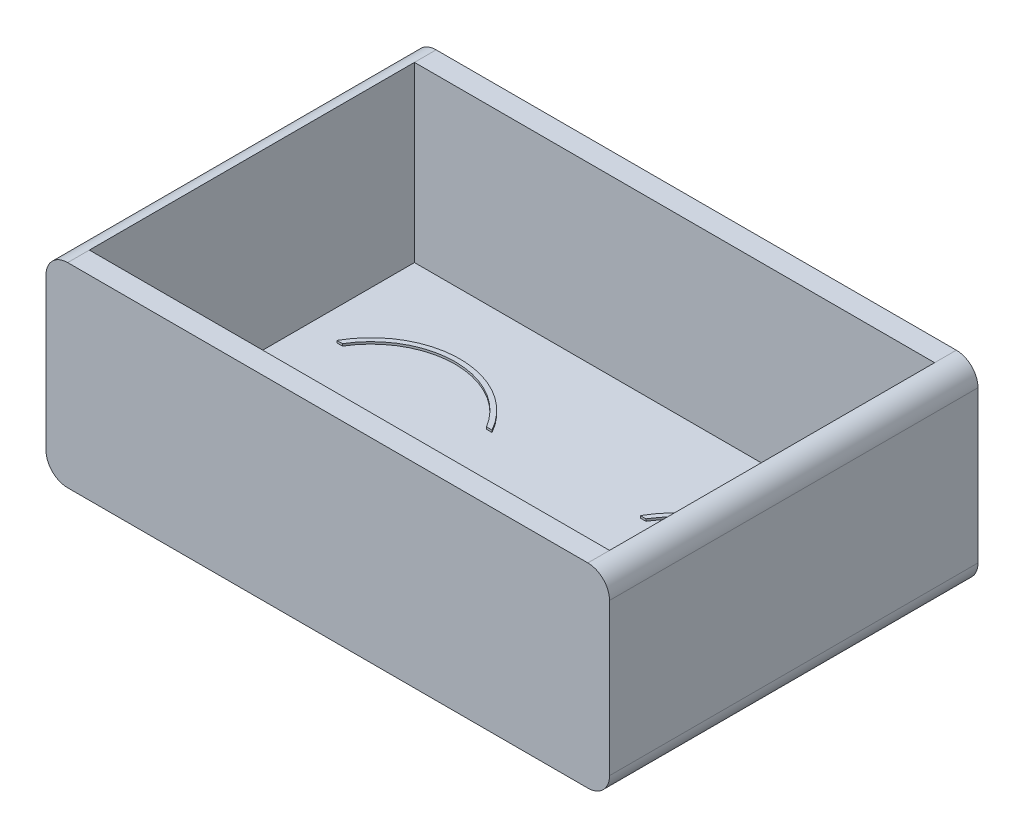
from build123d import *

# Parameters (mm, degrees)
SKETCH1_W           = 260
SKETCH1_H           = 90
BOSS_EXTRUDE1_DEPTH = 10
BOSS_EXTRUDE2_DEPTH = 160
SKETCH3_W           = 240
SKETCH3_H           = 10
BOSS_EXTRUDE3_DEPTH = 80
SKETCH4_R           = 5
BOSS_EXTRUDE4_DEPTH = 15
BOSS_EXTRUDE5_DEPTH = 5
BOSS_EXTRUDE6_DEPTH = 1
BOSS_EXTRUDE7_DEPTH = 1
CUT_EXTRUDE1_DEPTH  = 209


with BuildPart() as part:
    # Sketch1 → Boss-Extrude1 (new body)
    with BuildSketch(Plane.XY):
        Rectangle(SKETCH1_W, SKETCH1_H)
    extrude(amount=BOSS_EXTRUDE1_DEPTH)

    # Sketch2 → Boss-Extrude2 (add)
    with BuildSketch(Plane.XY.offset(10)):
        Polygon((-130, 45), (-130, -45), (130, -45), (130, 45), (120, 45), (120, -35), (-120, -35), (-120, 45), align=None)
    extrude(amount=BOSS_EXTRUDE2_DEPTH)

    # Sketch3 → Boss-Extrude3 (add)
    with BuildSketch(Plane(origin=(0, -35, 0), x_dir=(1, 0, 0), z_dir=(0, 1, 0))):
        with Locations((0, -165)):
            Rectangle(SKETCH3_W, SKETCH3_H)
    extrude(amount=BOSS_EXTRUDE3_DEPTH)

    # Sketch4 → Boss-Extrude4 (add)
    with BuildSketch(Plane(origin=(0, 0, 0), x_dir=(-1, 0, 0), z_dir=(0, 0, -1))):
        with Locations((-40, 0)):
            Circle(SKETCH4_R)
        with Locations((40, 0)):
            Circle(SKETCH4_R)
    extrude(amount=BOSS_EXTRUDE4_DEPTH)

    # Sketch5 → Boss-Extrude5 (add)
    with BuildSketch(Plane(origin=(0, 0, -15), x_dir=(-1, 0, 0), z_dir=(0, 0, -1))):
        with BuildLine():
            Line((-45, 7.5), (45, 7.5))
            ThreePointArc((45, 7.5), (48.535533906, 6.035533906), (50, 2.5))
            Line((50, 2.5), (50, -2.5))
            ThreePointArc((50, -2.5), (48.535533906, -6.035533906), (45, -7.5))
            Line((45, -7.5), (-45, -7.5))
            ThreePointArc((-45, -7.5), (-48.535533906, -6.035533906), (-50, -2.5))
            Line((-50, -2.5), (-50, 2.5))
            ThreePointArc((-50, 2.5), (-48.535533906, 6.035533906), (-45, 7.5))
        make_face()
    extrude(amount=BOSS_EXTRUDE5_DEPTH)

    # Sketch6 → Boss-Extrude6 (add)
    # profile 1 of 7: a face of its own
    with BuildSketch(Plane(origin=(0, 0, -20), x_dir=(-1, 0, 0), z_dir=(0, 0, -1))):
        with BuildLine():
            Line((-17.903472222, -1.672949219), (-17.321940104, -1.324305556))
            add(Edge.make_bspline(
                [(-17.321940104, -1.324305556), (-17.267853664, -1.414844007), (-17.164226132, -1.588312187), (-16.99135983, -1.822711026), (-16.812240263, -2.021935932), (-16.625540989, -2.184827931), (-16.432401608, -2.313073064), (-16.231561283, -2.403882451), (-16.023696824, -2.460519564), (-15.882233992, -2.467398901), (-15.811610243, -2.470833333)],
                knots=[0, 0, 0, 0, 1.272034388, 2.437168799, 3.508375237, 4.49857839, 5.41946034, 6.295179144, 7.148887113, 8, 8, 8, 8], degree=3))
            add(Edge.make_bspline(
                [(-15.811610243, -2.470833333), (-15.751295949, -2.469153495), (-15.63172272, -2.465823211), (-15.455690264, -2.433823682), (-15.284729603, -2.384662938), (-15.122364292, -2.31425775), (-14.970834698, -2.229076989), (-14.837955348, -2.126191823), (-14.723080904, -2.011002721), (-14.629113227, -1.88249467), (-14.557019491, -1.744287989), (-14.501608652, -1.602427875), (-14.470858632, -1.454685844), (-14.46622649, -1.355212184), (-14.463888889, -1.305013021)],
                knots=[0, 0, 0, 0, 1.095163259, 2.171163733, 3.241058638, 4.321873601, 5.38011039, 6.391990106, 7.366004449, 8.327778327, 9.272591725, 10.192022065, 11.087607919, 12, 12, 12, 12], degree=3))
            add(Edge.make_bspline(
                [(-14.463888889, -1.305013021), (-14.466786611, -1.247737375), (-14.472677258, -1.131304355), (-14.522465679, -0.959522418), (-14.600788425, -0.789523331), (-14.673044526, -0.684367868), (-14.710557726, -0.629774306)],
                knots=[0, 0, 0, 0, 0.938893495, 1.908633276, 2.914225137, 4, 4, 4, 4], degree=3))
            add(Edge.make_bspline(
                [(-14.710557726, -0.629774306), (-14.741357945, -0.590372751), (-14.806019152, -0.507654116), (-14.917181596, -0.384526397), (-15.047622614, -0.257520433), (-15.192878291, -0.121786501), (-15.358239874, 0.01636249), (-15.53852812, 0.163514307), (-15.738346014, 0.314072883), (-15.878483477, 0.415044438), (-15.950792101, 0.467144097)],
                knots=[0, 0, 0, 0, 0.722233717, 1.516239348, 2.393582979, 3.351407094, 4.387010283, 5.505090956, 6.712668013, 8, 8, 8, 8], degree=3))
            add(Edge.make_bspline(
                [(-15.950792101, 0.467144097), (-16.023168788, 0.518695762), (-16.161547504, 0.617258619), (-16.355065503, 0.763537777), (-16.528114799, 0.897276382), (-16.679926247, 1.019733435), (-16.810433074, 1.130925542), (-16.920663683, 1.229784944), (-17.007810061, 1.318985252), (-17.056270018, 1.376851509), (-17.078027344, 1.402832031)],
                knots=[0, 0, 0, 0, 1.452282411, 2.77665338, 3.964542531, 5.026858415, 5.96415736, 6.766646006, 7.446254459, 8, 8, 8, 8], degree=3))
            add(Edge.make_bspline(
                [(-17.078027344, 1.402832031), (-17.108438263, 1.443322879), (-17.168245417, 1.522953564), (-17.247190744, 1.647417065), (-17.314290456, 1.774825649), (-17.366891183, 1.905521688), (-17.411185584, 2.03767034), (-17.440978136, 2.172995824), (-17.459633251, 2.310890918), (-17.461543667, 2.403687929), (-17.4625, 2.450141059)],
                knots=[0, 0, 0, 0, 1.068054152, 2.10047183, 3.106115577, 4.101338837, 5.06977816, 6.043150881, 7.020423561, 8, 8, 8, 8], degree=3))
            add(Edge.make_bspline(
                [(-17.4625, 2.450141059), (-17.459934643, 2.522922199), (-17.454858761, 2.666928834), (-17.411931744, 2.877295383), (-17.344176093, 3.078140353), (-17.249253641, 3.26747533), (-17.126888296, 3.440370371), (-16.985283648, 3.598814261), (-16.816623215, 3.732011795), (-16.631568476, 3.848391686), (-16.42901363, 3.939483499), (-16.216760081, 4.008198473), (-15.994470479, 4.047133097), (-15.843908842, 4.052720484), (-15.767513021, 4.055555556)],
                knots=[0, 0, 0, 0, 1.005424448, 1.989358655, 2.955360095, 3.929531133, 4.905563448, 5.876582895, 6.856512386, 7.866279853, 8.892233794, 9.918561126, 10.94386622, 12, 12, 12, 12], degree=3))
            add(Edge.make_bspline(
                [(-15.767513021, 4.055555556), (-15.686448724, 4.052759564), (-15.52523771, 4.04719923), (-15.288104549, 3.998853368), (-15.059793427, 3.918857166), (-14.876132915, 3.828074459), (-14.732392213, 3.73740426), (-14.622772235, 3.654815296), (-14.511688531, 3.559735171), (-14.398245069, 3.451910629), (-14.284364082, 3.330352313), (-14.168354892, 3.195892732), (-14.049946216, 3.049353597), (-13.973772496, 2.944742108), (-13.934722222, 2.891113281)],
                knots=[0, 0, 0, 0, 1.286793592, 2.559021753, 3.825965368, 5.121522368, 5.803751409, 6.523245864, 7.299691795, 8.125521123, 9.008227632, 9.944561021, 10.946284179, 12, 12, 12, 12], degree=3))
            Line((-13.934722222, 2.891113281), (-14.492827691, 2.468055556))
            add(Edge.make_bspline(
                [(-14.492827691, 2.468055556), (-14.526527613, 2.511470351), (-14.591425784, 2.595077095), (-14.689954096, 2.712163098), (-14.782820189, 2.819117393), (-14.874313891, 2.912015876), (-14.959603041, 2.995945903), (-15.042383085, 3.067803234), (-15.121462744, 3.128291934), (-15.221145624, 3.19284517), (-15.346381283, 3.256834202), (-15.503588984, 3.310981259), (-15.667875818, 3.343519839), (-15.779769653, 3.347822046), (-15.836414931, 3.35)],
                knots=[0, 0, 0, 0, 1.181633172, 2.275549214, 3.290209073, 4.226197932, 5.078386478, 5.862611352, 6.581680152, 7.217281963, 8.414376989, 9.595101626, 10.782541182, 12, 12, 12, 12], degree=3))
            add(Edge.make_bspline(
                [(-15.836414931, 3.35), (-15.907479714, 3.347618433), (-16.044521456, 3.343025804), (-16.239084408, 3.292866881), (-16.414196396, 3.213890391), (-16.56465864, 3.103204642), (-16.689932151, 2.97206612), (-16.780551333, 2.821159108), (-16.83509362, 2.654521315), (-16.841749272, 2.538279797), (-16.845138889, 2.479079861)],
                knots=[0, 0, 0, 0, 1.14458467, 2.207223713, 3.21896685, 4.227309161, 5.202851033, 6.127160689, 7.046193047, 8, 8, 8, 8], degree=3))
            add(Edge.make_bspline(
                [(-16.845138889, 2.479079861), (-16.844366208, 2.442224277), (-16.842819582, 2.368452841), (-16.821248879, 2.259464392), (-16.793536983, 2.150751271), (-16.749623073, 2.042802242), (-16.688997363, 1.933729401), (-16.609385404, 1.821654533), (-16.509119954, 1.705589806), (-16.432315016, 1.630101027), (-16.391764323, 1.590245226)],
                knots=[0, 0, 0, 0, 0.858281714, 1.717966888, 2.583508476, 3.4729293, 4.427298488, 5.488583878, 6.674047936, 8, 8, 8, 8], degree=3))
            add(Edge.make_bspline(
                [(-16.391764323, 1.590245226), (-16.376706078, 1.576807214), (-16.340931134, 1.544881575), (-16.275528095, 1.492615081), (-16.189159571, 1.428142013), (-16.084080888, 1.348368608), (-15.958354561, 1.255831116), (-15.811966767, 1.151712742), (-15.646549278, 1.032633465), (-15.529167274, 0.949380728), (-15.467100694, 0.905360243)],
                knots=[0, 0, 0, 0, 0.420754252, 0.999615792, 1.744751191, 2.668019286, 3.750313428, 4.999500688, 6.413464383, 8, 8, 8, 8], degree=3))
            add(Edge.make_bspline(
                [(-15.467100694, 0.905360243), (-15.392440286, 0.851031809), (-15.247870754, 0.745832326), (-15.042168772, 0.587777222), (-14.855657252, 0.433196905), (-14.68768136, 0.283078537), (-14.536581627, 0.138560821), (-14.404034392, -0.002094906), (-14.288689085, -0.137880954), (-14.164511835, -0.311968243), (-14.037624978, -0.525774874), (-13.928656015, -0.787730079), (-13.859946216, -1.050703561), (-13.850961011, -1.227452617), (-13.846527778, -1.314659288)],
                knots=[0, 0, 0, 0, 1.163667725, 2.253281268, 3.268753668, 4.215851969, 5.092017293, 5.902905408, 6.650798638, 7.335211899, 8.59617414, 9.77448103, 10.901945474, 12, 12, 12, 12], degree=3))
            add(Edge.make_bspline(
                [(-13.846527778, -1.314659288), (-13.847819367, -1.376332718), (-13.850377464, -1.49848192), (-13.879782784, -1.677841601), (-13.922865364, -1.852043465), (-13.987799261, -2.018934235), (-14.067053468, -2.181567096), (-14.16761951, -2.335675957), (-14.284187352, -2.484671629), (-14.417906097, -2.624581086), (-14.564227746, -2.753017479), (-14.718878674, -2.867268765), (-14.882112008, -2.962532101), (-15.053042233, -3.040268339), (-15.231708612, -3.101067431), (-15.418051053, -3.145119392), (-15.612376724, -3.172155914), (-15.74445767, -3.174962145), (-15.811610243, -3.176388889)],
                knots=[0, 0, 0, 0, 0.983748083, 1.948392443, 2.894712957, 3.844097841, 4.80183111, 5.778335162, 6.776009319, 7.81870978, 8.863265674, 9.881300176, 10.883814829, 11.87499822, 12.874611388, 13.892143829, 14.928324115, 16, 16, 16, 16], degree=3))
            add(Edge.make_bspline(
                [(-15.811610243, -3.176388889), (-15.86356828, -3.175384174), (-15.966829997, -3.173387396), (-16.119566133, -3.155734904), (-16.269216683, -3.130759394), (-16.413903801, -3.09110774), (-16.555491619, -3.042998824), (-16.693364338, -2.983762649), (-16.827588779, -2.91277515), (-16.958917147, -2.831610762), (-17.087015435, -2.737154409), (-17.210682151, -2.627139835), (-17.333974872, -2.504601229), (-17.453254504, -2.366210943), (-17.570933744, -2.214204783), (-17.68469238, -2.047160566), (-17.796885137, -1.865988172), (-17.867279586, -1.738497391), (-17.903472222, -1.672949219)],
                knots=[0, 0, 0, 0, 0.915332311, 1.819136955, 2.706846663, 3.586547465, 4.459518054, 5.340707479, 6.227863349, 7.133153174, 8.059268498, 9.028702269, 10.047606654, 11.120612155, 12.245963614, 13.433783089, 14.680604001, 16, 16, 16, 16], degree=3))
        make_face()
    # profile 2 of 7: a face of its own
    with BuildSketch(Plane(origin=(0, 0, -20), x_dir=(-1, 0, 0), z_dir=(0, 0, -1))):
        Polygon((-11.994444444, 4.055555556), (-11.377083333, 4.055555556), (-11.377083333, 2.027083333), (-10.495138889, 2.027083333), (-10.495138889, 1.409722222), (-11.377083333, 1.409722222), (-11.377083333, -3), (-11.994444444, -3), (-11.994444444, 1.409722222), (-12.876388889, 1.409722222), (-12.876388889, 2.027083333), (-11.994444444, 2.027083333), align=None)
    # profile 3 of 7: a face of its own
    with BuildSketch(Plane(origin=(0, 0, -20), x_dir=(-1, 0, 0), z_dir=(0, 0, -1))):
        with BuildLine():
            add(Edge.make_bspline(
                [(-7.008702257, 2.115277778), (-6.914376553, 2.113269275), (-6.729426899, 2.109331092), (-6.458568781, 2.067240487), (-6.200019948, 2.002876322), (-5.952790182, 1.913896145), (-5.720045773, 1.794627216), (-5.498396578, 1.652308478), (-5.28845029, 1.483704833), (-5.16261455, 1.353279629), (-5.098741319, 1.287076823)],
                knots=[0, 0, 0, 0, 1.054011418, 2.066658804, 3.057071809, 4.030435133, 4.997543892, 5.974964718, 6.972108034, 8, 8, 8, 8], degree=3))
            add(Edge.make_bspline(
                [(-5.098741319, 1.287076823), (-5.043743455, 1.223761001), (-4.934812086, 1.098354692), (-4.795134108, 0.895015148), (-4.674804589, 0.684433831), (-4.578372507, 0.463814383), (-4.502338014, 0.235082738), (-4.448354842, -0.002547286), (-4.416244986, -0.248550899), (-4.411915107, -0.415623919), (-4.409722222, -0.500238715)],
                knots=[0, 0, 0, 0, 1.025258237, 2.030674902, 3.01204498, 3.988269485, 4.97094183, 5.956517959, 6.965070386, 8, 8, 8, 8], degree=3))
            add(Edge.make_bspline(
                [(-4.409722222, -0.500238715), (-4.411651017, -0.585343948), (-4.415462406, -0.753515856), (-4.451516348, -1.001203919), (-4.507593518, -1.241374934), (-4.587847523, -1.47302339), (-4.690756141, -1.696857376), (-4.816331766, -1.91189924), (-4.965455623, -2.118573254), (-5.134494431, -2.315124486), (-5.32131663, -2.496274987), (-5.523988965, -2.654158288), (-5.738528619, -2.789425356), (-5.967788353, -2.898384311), (-6.209674568, -2.984294686), (-6.464708996, -3.044634837), (-6.732495437, -3.081117385), (-6.915338226, -3.085802241), (-7.008702257, -3.088194444)],
                knots=[0, 0, 0, 0, 0.998656419, 1.973391657, 2.932242238, 3.890759089, 4.846373663, 5.82037756, 6.809684879, 7.83454468, 8.860553229, 9.859544525, 10.845671541, 11.83227036, 12.833544569, 13.85385346, 14.904124723, 16, 16, 16, 16], degree=3))
            add(Edge.make_bspline(
                [(-7.008702257, -3.088194444), (-7.102523712, -3.085794212), (-7.28627777, -3.081093237), (-7.555009433, -3.044776577), (-7.810500934, -2.984322495), (-8.05270381, -2.898101982), (-8.282949217, -2.789421873), (-8.498731963, -2.654567231), (-8.70156894, -2.496228164), (-8.888430662, -2.315137173), (-9.057458873, -2.118569985), (-9.206585464, -1.911900088), (-9.332160379, -1.696857155), (-9.435069182, -1.473023449), (-9.515323138, -1.241374918), (-9.571400322, -1.001203923), (-9.607454259, -0.753515855), (-9.611265649, -0.585343947), (-9.613194444, -0.500238715)],
                knots=[0, 0, 0, 0, 1.099876186, 2.154163076, 3.173186993, 4.173200201, 5.163417411, 6.152872554, 7.150605724, 8.17532212, 9.198891216, 10.186952605, 11.159729845, 12.11414092, 13.071450619, 14.029093627, 15.002601286, 16, 16, 16, 16], degree=3))
            add(Edge.make_bspline(
                [(-9.613194444, -0.500238715), (-9.610986605, -0.416083814), (-9.606615461, -0.249471572), (-9.574537889, -0.003930408), (-9.520765298, 0.233297436), (-9.44463966, 0.461146199), (-9.347318732, 0.680798848), (-9.228680057, 0.891900486), (-9.087577278, 1.094320555), (-8.979079157, 1.219564787), (-8.924175347, 1.282942708)],
                knots=[0, 0, 0, 0, 1.031353054, 2.041901799, 3.029428768, 4.008703097, 4.981709435, 5.96992636, 6.972712378, 8, 8, 8, 8], degree=3))
            add(Edge.make_bspline(
                [(-8.924175347, 1.282942708), (-8.860398414, 1.349719643), (-8.734969853, 1.481048234), (-8.523978485, 1.649160373), (-8.302874558, 1.794440656), (-8.067558066, 1.911339742), (-7.820531401, 2.003399733), (-7.560657628, 2.067406478), (-7.288880395, 2.109179441), (-7.103025711, 2.11322474), (-7.008702257, 2.115277778)],
                knots=[0, 0, 0, 0, 1.027980169, 2.021703884, 2.998553061, 3.971491411, 4.943284454, 5.930300938, 6.949603206, 8, 8, 8, 8], degree=3))
        make_face()
        with BuildLine():
            add(Edge.make_bspline(
                [(-7.011458333, 1.497916667), (-7.0781619, 1.496020785), (-7.209847093, 1.492277963), (-7.403681538, 1.463810193), (-7.59028415, 1.41870742), (-7.770008952, 1.354624924), (-7.942249866, 1.27188054), (-8.107171799, 1.170248989), (-8.265259844, 1.051076357), (-8.413421495, 0.91454913), (-8.549397682, 0.765410773), (-8.668265705, 0.606505248), (-8.769340528, 0.440410037), (-8.85354184, 0.266952417), (-8.916254658, 0.084374589), (-8.961800682, -0.105255794), (-8.990241596, -0.302325083), (-8.993949228, -0.436293942), (-8.995833333, -0.50437283)],
                knots=[0, 0, 0, 0, 1.021534396, 2.016698045, 2.994645724, 3.958388632, 4.93408049, 5.916473867, 6.921342795, 7.962252576, 8.998418191, 10.008913653, 10.997312074, 11.973003931, 12.956656626, 13.948281152, 14.957379055, 16, 16, 16, 16], degree=3))
            add(Edge.make_bspline(
                [(-8.995833333, -0.50437283), (-8.99267516, -0.592331874), (-8.986406776, -0.766914128), (-8.935431686, -1.024020275), (-8.850156986, -1.270848415), (-8.735005083, -1.505951574), (-8.590726908, -1.723475301), (-8.420738637, -1.917411755), (-8.226864655, -2.084842439), (-8.011416033, -2.223763958), (-7.77879344, -2.33414462), (-7.532605123, -2.41236856), (-7.275833949, -2.463218755), (-7.100354798, -2.468272927), (-7.011458333, -2.470833333)],
                knots=[0, 0, 0, 0, 1.016792936, 2.018143844, 3.017858371, 4.030088057, 5.03801393, 6.028138512, 7.003788237, 7.991172063, 8.984598303, 9.972568034, 10.972917682, 12, 12, 12, 12], degree=3))
            add(Edge.make_bspline(
                [(-7.011458333, -2.470833333), (-6.922566982, -2.468258009), (-6.747097924, -2.463174389), (-6.490683518, -2.412624661), (-6.24516808, -2.333801871), (-6.012787103, -2.223888099), (-5.797436553, -2.084314889), (-5.60216822, -1.9183572), (-5.433631367, -1.722961642), (-5.289495912, -1.505663452), (-5.172458207, -1.271212898), (-5.087582652, -1.023974719), (-5.036485016, -0.76692573), (-5.030233173, -0.592335761), (-5.027083333, -0.50437283)],
                knots=[0, 0, 0, 0, 1.02726834, 2.027799167, 3.010890988, 4.004497153, 4.992059811, 5.971914811, 6.958719428, 7.966827853, 8.981595046, 9.981490638, 10.983022906, 12, 12, 12, 12], degree=3))
            add(Edge.make_bspline(
                [(-5.027083333, -0.50437283), (-5.02896679, -0.436293535), (-5.032673146, -0.302323876), (-5.061123344, -0.10526041), (-5.106635006, 0.084391525), (-5.169474458, 0.266889927), (-5.253309907, 0.440859147), (-5.356333866, 0.606017575), (-5.474716512, 0.765961238), (-5.612333496, 0.914067025), (-5.760340492, 1.051129579), (-5.918492609, 1.170295201), (-6.08316999, 1.271433879), (-6.254910513, 1.355332669), (-6.434658358, 1.418124406), (-6.620999513, 1.464070618), (-6.814006936, 1.49215766), (-6.945220245, 1.49598472), (-7.011458333, 1.497916667)],
                knots=[0, 0, 0, 0, 1.042956736, 2.052379634, 3.044323526, 4.02829302, 5.004299113, 5.996692471, 7.007513377, 8.048758398, 9.090003419, 10.095195979, 11.07790575, 12.047570684, 13.018257071, 13.989683339, 14.985167495, 16, 16, 16, 16], degree=3))
        make_face(mode=Mode.SUBTRACT)
    # profile 4 of 7: a face of its own
    with BuildSketch(Plane(origin=(0, 0, -20), x_dir=(-1, 0, 0), z_dir=(0, 0, -1))):
        with BuildLine():
            Line((-3.351388889, 2.027083333), (-2.734027778, 2.027083333))
            Line((-2.734027778, 2.027083333), (-2.734027778, 1.287076823))
            add(Edge.make_bspline(
                [(-2.734027778, 1.287076823), (-2.688450825, 1.355978219), (-2.601285256, 1.487751603), (-2.456404248, 1.662029003), (-2.308004248, 1.806324529), (-2.155374826, 1.921311802), (-1.997393585, 2.007425444), (-1.837527743, 2.070503541), (-1.673262147, 2.107803002), (-1.562877222, 2.112782848), (-1.507573785, 2.115277778)],
                knots=[0, 0, 0, 0, 1.2804753, 2.448899062, 3.506932113, 4.484331642, 5.4025378, 6.288909075, 7.142734305, 8, 8, 8, 8], degree=3))
            add(Edge.make_bspline(
                [(-1.507573785, 2.115277778), (-1.46467466, 2.112937826), (-1.376406922, 2.108123223), (-1.24278876, 2.074295757), (-1.105120023, 2.020288358), (-1.016393736, 1.969500016), (-0.970138889, 1.943023003)],
                knots=[0, 0, 0, 0, 0.901110191, 1.854092781, 2.881294221, 4, 4, 4, 4], degree=3))
            Line((-0.970138889, 1.943023003), (-1.309136285, 1.408344184))
            add(Edge.make_bspline(
                [(-1.309136285, 1.408344184), (-1.338832706, 1.421592017), (-1.395202199, 1.446738939), (-1.4776629, 1.476500199), (-1.553690146, 1.49402422), (-1.602126473, 1.496679023), (-1.624707031, 1.497916667)],
                knots=[0, 0, 0, 0, 1.180555205, 2.24091978, 3.179933427, 4, 4, 4, 4], degree=3))
            add(Edge.make_bspline(
                [(-1.624707031, 1.497916667), (-1.6742483, 1.494614593), (-1.775298129, 1.487879321), (-1.923661115, 1.434931735), (-2.067626753, 1.349383912), (-2.181961771, 1.254508191), (-2.270491246, 1.163019604), (-2.333662094, 1.083126136), (-2.391609732, 0.993542421), (-2.446977629, 0.895799912), (-2.497424119, 0.788229702), (-2.544506451, 0.671906505), (-2.587076431, 0.546695592), (-2.611350542, 0.459462805), (-2.623784722, 0.414778646)],
                knots=[0, 0, 0, 0, 1.125678352, 2.296057538, 3.5422874, 4.923748041, 5.663163013, 6.437101912, 7.23742474, 8.08941207, 8.991984279, 9.93940061, 10.944477711, 12, 12, 12, 12], degree=3))
            add(Edge.make_bspline(
                [(-2.623784722, 0.414778646), (-2.633086129, 0.374924344), (-2.653688037, 0.286650094), (-2.673719262, 0.138554362), (-2.69351066, -0.036419519), (-2.707458894, -0.238758596), (-2.72038788, -0.467957579), (-2.727679958, -0.724365634), (-2.733779107, -1.008245946), (-2.733942373, -1.206708633), (-2.734027778, -1.310525174)],
                knots=[0, 0, 0, 0, 0.566838948, 1.255505196, 2.06880316, 3.007127437, 4.065329342, 5.249902469, 6.561414163, 8, 8, 8, 8], degree=3))
            Line((-2.734027778, -1.310525174), (-2.734027778, -3))
            Line((-2.734027778, -3), (-3.351388889, -3))
            Line((-3.351388889, -3), (-3.351388889, 2.027083333))
        make_face()
    # profile 5 of 7: a face of its own
    with BuildSketch(Plane(origin=(0, 0, -20), x_dir=(-1, 0, 0), z_dir=(0, 0, -1))):
        with BuildLine():
            Line((4.7625, 2.027083333), (4.7625, -3))
            Line((4.7625, -3), (4.145138889, -3))
            Line((4.145138889, -3), (4.145138889, -2.130457899))
            add(Edge.make_bspline(
                [(4.145138889, -2.130457899), (4.075524099, -2.209154768), (3.939669962, -2.362732697), (3.712773193, -2.563372776), (3.472261453, -2.729216358), (3.219302071, -2.863163395), (2.954123476, -2.963780163), (2.677313499, -3.035296292), (2.388759226, -3.081276318), (2.191715609, -3.085867713), (2.091861979, -3.088194444)],
                knots=[0, 0, 0, 0, 1.074387032, 2.096679803, 3.090159297, 4.057316773, 5.018401886, 5.985159533, 6.978961417, 8, 8, 8, 8], degree=3))
            add(Edge.make_bspline(
                [(2.091861979, -3.088194444), (2.003085441, -3.085784039), (1.828014178, -3.081030613), (1.570479647, -3.044153752), (1.322648332, -2.984932732), (1.084286047, -2.902577531), (0.8569352, -2.79333475), (0.638649224, -2.662549511), (0.430558969, -2.506803546), (0.235836218, -2.328754933), (0.056521893, -2.135361929), (-0.100836632, -1.929093955), (-0.232038221, -1.710842951), (-0.341751261, -1.483372192), (-0.426259552, -1.244930606), (-0.485172017, -0.996342744), (-0.522005918, -0.737902528), (-0.52675738, -0.561914728), (-0.529166667, -0.472677951)],
                knots=[0, 0, 0, 0, 1.033919861, 2.038935746, 3.024066025, 3.998881131, 4.97069526, 5.957263378, 6.95902576, 7.993208707, 9.027059324, 10.027763471, 11.009749337, 11.988697705, 12.965288445, 13.950418724, 14.960734635, 16, 16, 16, 16], degree=3))
            add(Edge.make_bspline(
                [(-0.529166667, -0.472677951), (-0.526703981, -0.385285601), (-0.521835385, -0.212515638), (-0.485566021, 0.041578565), (-0.424575312, 0.286316242), (-0.338983054, 0.520909472), (-0.229227021, 0.745642118), (-0.095715984, 0.960673124), (0.061559701, 1.166594881), (0.24287961, 1.358565351), (0.439299021, 1.535891821), (0.649425587, 1.690002933), (0.868032298, 1.823098787), (1.098509953, 1.928553417), (1.337447203, 2.013872978), (1.586971178, 2.072902062), (1.846043698, 2.107685725), (2.021935129, 2.112722777), (2.111154514, 2.115277778)],
                knots=[0, 0, 0, 0, 1.020392517, 2.01726096, 2.990465484, 3.961182959, 4.928053699, 5.906110375, 6.912531644, 7.948652711, 8.985773172, 9.998621852, 10.987621588, 11.969261332, 12.953316658, 13.946091881, 14.958173133, 16, 16, 16, 16], degree=3))
            add(Edge.make_bspline(
                [(2.111154514, 2.115277778), (2.213752094, 2.112451911), (2.414941106, 2.106910521), (2.709227944, 2.060795089), (2.987626793, 1.982886625), (3.252286715, 1.876913067), (3.502257326, 1.736089196), (3.73517212, 1.558449534), (3.953468683, 1.345114415), (4.080006613, 1.181251792), (4.145138889, 1.096907552)],
                knots=[0, 0, 0, 0, 1.038897134, 2.037228247, 3.008116434, 3.962042015, 4.918381754, 5.904844433, 6.921570401, 8, 8, 8, 8], degree=3))
            Line((4.145138889, 1.096907552), (4.145138889, 2.027083333))
            Line((4.145138889, 2.027083333), (4.7625, 2.027083333))
        make_face()
        with BuildLine():
            add(Edge.make_bspline(
                [(2.119422743, 1.497916667), (2.029179205, 1.494705791), (1.851052815, 1.488368032), (1.589557997, 1.438890127), (1.339326513, 1.356566954), (1.101609883, 1.243980741), (0.880163186, 1.102409974), (0.682252174, 0.931174969), (0.506258126, 0.734947695), (0.358241526, 0.514613666), (0.237579966, 0.27840649), (0.152736192, 0.031494648), (0.096780564, -0.221668469), (0.091063937, -0.393377748), (0.088194444, -0.479568142)],
                knots=[0, 0, 0, 0, 1.031046209, 2.035121221, 3.029706178, 4.034933723, 5.034054252, 6.02443088, 7.017295772, 8.038157696, 9.050218397, 10.03989886, 11.016116709, 12, 12, 12, 12], degree=3))
            add(Edge.make_bspline(
                [(0.088194444, -0.479568142), (0.091859848, -0.56524346), (0.099176287, -0.736258277), (0.15175414, -0.98976653), (0.239964463, -1.236736558), (0.360334279, -1.475072154), (0.511060014, -1.696353522), (0.685768544, -1.896321311), (0.886149395, -2.068280014), (1.108105721, -2.212226721), (1.345157816, -2.328509247), (1.594446888, -2.409419331), (1.851286744, -2.461657326), (2.02592389, -2.467759102), (2.11391059, -2.470833333)],
                knots=[0, 0, 0, 0, 0.979072187, 1.954306742, 2.945804271, 3.96968567, 4.997920485, 5.998718438, 6.996577872, 8.005894225, 9.015743152, 10.005417472, 10.995077863, 12, 12, 12, 12], degree=3))
            add(Edge.make_bspline(
                [(2.11391059, -2.470833333), (2.203234609, -2.467570714), (2.380891224, -2.461081687), (2.643161827, -2.411391962), (2.897681093, -2.329296383), (3.140981944, -2.215497028), (3.367633054, -2.074459654), (3.571055668, -1.909345717), (3.74306622, -1.717312434), (3.888890028, -1.506266573), (4.003232424, -1.274906446), (4.086521559, -1.028565078), (4.135764415, -0.767233894), (4.141970857, -0.588643009), (4.145138889, -0.497482639)],
                knots=[0, 0, 0, 0, 1.01762866, 2.023962475, 3.030623092, 4.058876274, 5.077231937, 6.066672613, 7.034107872, 8.005628644, 8.981990164, 9.965428785, 10.961468474, 12, 12, 12, 12], degree=3))
            add(Edge.make_bspline(
                [(4.145138889, -0.497482639), (4.143252707, -0.428026974), (4.139540105, -0.291316247), (4.111177164, -0.090587043), (4.066059802, 0.101506269), (4.002484175, 0.285165649), (3.918968568, 0.459375662), (3.818242304, 0.625387171), (3.698534093, 0.782336757), (3.56177096, 0.928063198), (3.412070068, 1.060981399), (3.253663417, 1.179625877), (3.084674237, 1.277091429), (2.907944442, 1.357757071), (2.723167403, 1.421947853), (2.528839553, 1.464771046), (2.327026449, 1.494175201), (2.189352595, 1.49665638), (2.119422743, 1.497916667)],
                knots=[0, 0, 0, 0, 1.050140795, 2.067009409, 3.05949893, 4.030605086, 5.00011959, 5.97591094, 6.962425594, 7.979863591, 8.993523472, 9.986985069, 10.967611495, 11.937549037, 12.921786183, 13.919465291, 14.943216303, 16, 16, 16, 16], degree=3))
        make_face(mode=Mode.SUBTRACT)
    # profile 6 of 7: a face of its own
    with BuildSketch(Plane(origin=(0, 0, -20), x_dir=(-1, 0, 0), z_dir=(0, 0, -1))):
        with BuildLine():
            Line((10.583333333, 2.027083333), (11.200694444, 2.027083333))
            Line((11.200694444, 2.027083333), (11.200694444, -1.96233724))
            add(Edge.make_bspline(
                [(11.200694444, -1.96233724), (11.200149924, -2.047319702), (11.199098868, -2.211356326), (11.191529876, -2.448546611), (11.175568878, -2.667630548), (11.157469434, -2.869607321), (11.131433328, -3.05354073), (11.099639064, -3.219979622), (11.063797271, -3.369083716), (11.032309915, -3.460920279), (11.017415365, -3.504361979)],
                knots=[0, 0, 0, 0, 1.307562039, 2.523909702, 3.650326591, 4.686913197, 5.643429486, 6.506965704, 7.293745905, 8, 8, 8, 8], degree=3))
            add(Edge.make_bspline(
                [(11.017415365, -3.504361979), (10.995423182, -3.560829956), (10.95209637, -3.672077554), (10.87095044, -3.829776201), (10.780078803, -3.978260831), (10.676288392, -4.116703965), (10.56004855, -4.244410608), (10.434097903, -4.364155278), (10.295983515, -4.473404636), (10.145784356, -4.570273714), (9.986962807, -4.657515412), (9.819610171, -4.733081225), (9.644670136, -4.798898819), (9.460499333, -4.848198456), (9.269985265, -4.890917532), (9.070887576, -4.918718575), (8.864369496, -4.937640329), (8.723945302, -4.939390061), (8.652701823, -4.940277778)],
                knots=[0, 0, 0, 0, 0.981931301, 1.934503488, 2.87077864, 3.801706999, 4.735015492, 5.667491629, 6.616593066, 7.585388521, 8.561939025, 9.551802639, 10.560317337, 11.588439944, 12.640189604, 13.723962949, 14.845264515, 16, 16, 16, 16], degree=3))
            add(Edge.make_bspline(
                [(8.652701823, -4.940277778), (8.548758136, -4.938594375), (8.34572819, -4.935306238), (8.049717662, -4.896997308), (7.768586326, -4.842839844), (7.506048912, -4.760868819), (7.263764471, -4.660556831), (7.043387663, -4.545389846), (6.846896832, -4.413330859), (6.669760898, -4.26297075), (6.50988594, -4.084183799), (6.359473373, -3.873487024), (6.214694546, -3.627671031), (6.129847616, -3.447254638), (6.085416667, -3.352777778)],
                knots=[0, 0, 0, 0, 1.157897085, 2.2616841, 3.32207898, 4.345638746, 5.321241055, 6.241986252, 7.112515963, 7.955008012, 8.825025602, 9.77857164, 10.836726669, 12, 12, 12, 12], degree=3))
            Line((6.085416667, -3.352777778), (6.702777778, -3.352777778))
            add(Edge.make_bspline(
                [(6.702777778, -3.352777778), (6.752430049, -3.431604922), (6.849494124, -3.585702281), (7.031002865, -3.785223972), (7.229921489, -3.955735645), (7.452963105, -4.093143607), (7.70105576, -4.196743447), (7.974348711, -4.270596797), (8.275065825, -4.314812674), (8.484424839, -4.320141658), (8.593446181, -4.322916667)],
                knots=[0, 0, 0, 0, 0.997731894, 1.950442991, 2.880492273, 3.800895997, 4.748200782, 5.754801363, 6.83083817, 8, 8, 8, 8], degree=3))
            add(Edge.make_bspline(
                [(8.593446181, -4.322916667), (8.7010892, -4.320105743), (8.908614166, -4.314686564), (9.207034713, -4.270577064), (9.479439764, -4.196727375), (9.724259873, -4.093326844), (9.938606389, -3.966651105), (10.12338472, -3.825136673), (10.273045268, -3.665577344), (10.373703134, -3.518595485), (10.436273317, -3.387647344), (10.476117916, -3.274922182), (10.508497111, -3.147455395), (10.535581053, -3.005674323), (10.557930313, -2.8493764), (10.572087407, -2.678204251), (10.582319305, -2.492546899), (10.582987508, -2.363821695), (10.583333333, -2.297200521)],
                knots=[0, 0, 0, 0, 1.570740765, 3.028230971, 4.391408896, 5.680370741, 6.894727393, 8.017376726, 9.065722033, 10.075533815, 10.603371122, 11.180248986, 11.817768598, 12.521299649, 13.286540596, 14.121245857, 15.027658897, 16, 16, 16, 16], degree=3))
            Line((10.583333333, -2.297200521), (10.583333333, -2.036751302))
            add(Edge.make_bspline(
                [(10.583333333, -2.036751302), (10.520671756, -2.111325011), (10.3964508, -2.2591607), (10.181924327, -2.45288125), (9.947606318, -2.619722918), (9.693895689, -2.756556686), (9.427007132, -2.865997201), (9.149831296, -2.942538663), (8.864852863, -2.991989847), (8.671740602, -2.997311013), (8.574153646, -3)],
                knots=[0, 0, 0, 0, 1.012485704, 2.007162095, 2.997754123, 3.998611389, 4.999708251, 5.992315798, 6.98544096, 8, 8, 8, 8], degree=3))
            add(Edge.make_bspline(
                [(8.574153646, -3), (8.516690454, -2.998987728), (8.402444089, -2.996975162), (8.23271589, -2.979366899), (8.065492314, -2.95381818), (7.901163363, -2.916314066), (7.739491914, -2.868176161), (7.580745135, -2.80799969), (7.423637692, -2.739964499), (7.271025349, -2.659826525), (7.124428085, -2.570667991), (6.984951634, -2.474086671), (6.853326565, -2.370588059), (6.730805679, -2.259151574), (6.61754969, -2.139938499), (6.512035326, -2.014219659), (6.416007373, -1.880239552), (6.327495319, -1.74044121), (6.250728634, -1.59389349), (6.183343517, -1.443774162), (6.124753841, -1.290404213), (6.07804351, -1.133270165), (6.042367929, -0.972471081), (6.0158139, -0.808270387), (6.00075259, -0.640162446), (5.998403995, -0.526909056), (5.997222222, -0.469921875)],
                knots=[0, 0, 0, 0, 1.028754217, 2.045334182, 3.052854819, 4.056607503, 5.061168794, 6.071104265, 7.095078842, 8.125279047, 9.155117945, 10.165957491, 11.161587969, 12.151493252, 13.128948131, 14.104219989, 15.088194871, 16.07871515, 17.064853787, 18.047899887, 19.02414258, 20.002704429, 20.980574569, 21.971845993, 22.979467364, 24, 24, 24, 24], degree=3))
            add(Edge.make_bspline(
                [(5.997222222, -0.469921875), (5.998242631, -0.41291698), (6.000279497, -0.299127979), (6.017872434, -0.130334092), (6.042968006, 0.036199596), (6.082685895, 0.198756548), (6.130491234, 0.359188054), (6.189698398, 0.516309118), (6.260885507, 0.670167595), (6.341489194, 0.820877422), (6.432066381, 0.966416247), (6.531386769, 1.104641595), (6.639570262, 1.234536323), (6.755124372, 1.357410862), (6.879460037, 1.472079678), (7.012512932, 1.57826446), (7.152971522, 1.677745123), (7.301271123, 1.768375859), (7.455123466, 1.848532393), (7.610619791, 1.921672866), (7.769819894, 1.979721475), (7.929755683, 2.030869257), (8.093243825, 2.067103194), (8.258279738, 2.095056672), (8.425428428, 2.112086975), (8.537367987, 2.114212804), (8.593446181, 2.115277778)],
                knots=[0, 0, 0, 0, 1.008818848, 2.013730394, 3.001654427, 3.987803273, 4.973046549, 5.963777569, 6.957074694, 7.972068341, 8.987420212, 9.989399531, 10.982630087, 11.977756091, 12.973280677, 13.973972381, 14.989194003, 16.018387222, 17.047741039, 18.059210846, 19.057554164, 20.045176975, 21.029480261, 22.018708529, 23.007435371, 24, 24, 24, 24], degree=3))
            add(Edge.make_bspline(
                [(8.593446181, 2.115277778), (8.685923681, 2.112611269), (8.868538329, 2.107345733), (9.137279859, 2.066029172), (9.39660919, 2.000158177), (9.647989694, 1.905784598), (9.893469123, 1.776947559), (10.132238424, 1.60724255), (10.364988412, 1.395147347), (10.508621148, 1.232498562), (10.583333333, 1.147894965)],
                knots=[0, 0, 0, 0, 0.96728863, 1.910097829, 2.838038873, 3.762875196, 4.71315279, 5.730631239, 6.819562287, 8, 8, 8, 8], degree=3))
            Line((10.583333333, 1.147894965), (10.583333333, 2.027083333))
        make_face()
        with BuildLine():
            add(Edge.make_bspline(
                [(8.643055556, 1.497916667), (8.552779851, 1.49484843), (8.374053097, 1.488773971), (8.112078034, 1.436915445), (7.859166585, 1.355651063), (7.620154011, 1.239407661), (7.396272299, 1.097708153), (7.197612145, 0.926042897), (7.023854388, 0.729994122), (6.876870303, 0.51133441), (6.75986282, 0.275433485), (6.677030932, 0.02677965), (6.62347166, -0.230609271), (6.617560192, -0.406268994), (6.614583333, -0.494726562)],
                knots=[0, 0, 0, 0, 1.026226791, 2.031711442, 3.026614839, 4.04107745, 5.047145931, 6.032893242, 7.017642609, 8.019221815, 9.021877557, 10.003543541, 10.994637589, 12, 12, 12, 12], degree=3))
            add(Edge.make_bspline(
                [(6.614583333, -0.494726562), (6.616009791, -0.561421602), (6.618815216, -0.69259124), (6.645788582, -0.885085841), (6.689384741, -1.068426076), (6.751173821, -1.242623036), (6.827734415, -1.408675889), (6.924027754, -1.565440766), (7.037339366, -1.713057277), (7.166782361, -1.85043361), (7.309429512, -1.975557728), (7.464150224, -2.085502615), (7.630734649, -2.175424567), (7.805085773, -2.253141142), (7.991434056, -2.309902263), (8.187095415, -2.353218958), (8.393454094, -2.378001171), (8.534126644, -2.381072813), (8.605848524, -2.382638889)],
                knots=[0, 0, 0, 0, 1.039728707, 2.044842319, 3.024901384, 3.974314358, 4.923051295, 5.871625912, 6.837440708, 7.820715446, 8.810779094, 9.792721783, 10.773906224, 11.758876063, 12.764959493, 13.806266761, 14.881525401, 16, 16, 16, 16], degree=3))
            add(Edge.make_bspline(
                [(8.605848524, -2.382638889), (8.678499911, -2.381130172), (8.820568928, -2.378179891), (9.02806609, -2.352818372), (9.224678059, -2.311893273), (9.410224559, -2.253787851), (9.585406156, -2.179646648), (9.748254929, -2.085821463), (9.902262662, -1.978969466), (10.042511986, -1.854334662), (10.169332697, -1.716977368), (10.27985293, -1.567512938), (10.374027639, -1.408190417), (10.452013154, -1.239027767), (10.511549795, -1.058710356), (10.551486119, -0.867688957), (10.579409138, -0.666878734), (10.582005384, -0.529278465), (10.583333333, -0.458897569)],
                knots=[0, 0, 0, 0, 1.121943988, 2.193949579, 3.223793937, 4.220241907, 5.192961521, 6.155822191, 7.11847367, 8.083710714, 9.04790392, 10.001595906, 10.949595423, 11.902125208, 12.873731292, 13.87582262, 14.913508608, 16, 16, 16, 16], degree=3))
            add(Edge.make_bspline(
                [(10.583333333, -0.458897569), (10.580700444, -0.367271287), (10.575556703, -0.18826573), (10.527015028, 0.072566263), (10.448749353, 0.31779612), (10.338983891, 0.546648259), (10.201435919, 0.756697814), (10.035764263, 0.944054561), (9.844826053, 1.108959697), (9.629169877, 1.246342932), (9.397150434, 1.357324399), (9.154372465, 1.440585453), (8.901196403, 1.487745708), (8.729597733, 1.494506835), (8.643055556, 1.497916667)],
                knots=[0, 0, 0, 0, 1.070913519, 2.092188694, 3.091357305, 4.074328408, 5.051968682, 6.018948707, 6.99050112, 7.9935919, 9.000589572, 9.992915277, 10.987769056, 12, 12, 12, 12], degree=3))
        make_face(mode=Mode.SUBTRACT)
    # profile 7 of 7: a face of its own
    with BuildSketch(Plane(origin=(0, 0, -20), x_dir=(-1, 0, 0), z_dir=(0, 0, -1))):
        with BuildLine():
            Line((16.73765191, -1.4125), (17.286111111, -1.700509983))
            add(Edge.make_bspline(
                [(17.286111111, -1.700509983), (17.242405613, -1.778034911), (17.15737202, -1.928867722), (17.011139122, -2.136091533), (16.85784756, -2.32251246), (16.690577737, -2.48315015), (16.514334118, -2.62319305), (16.328139341, -2.745716561), (16.131024057, -2.850119748), (15.922978943, -2.938079776), (15.70225685, -3.005710817), (15.468322893, -3.053480185), (15.220728918, -3.083008062), (15.051017557, -3.086438094), (14.964116753, -3.088194444)],
                knots=[0, 0, 0, 0, 1.120438281, 2.179929193, 3.190490725, 4.156257408, 5.095198341, 6.022838206, 6.959905092, 7.901321166, 8.864066838, 9.862729781, 10.905609505, 12, 12, 12, 12], degree=3))
            add(Edge.make_bspline(
                [(14.964116753, -3.088194444), (14.867529367, -3.085939699), (14.679115357, -3.081541343), (14.404853306, -3.043622463), (14.146630187, -2.981764292), (13.904460518, -2.895351067), (13.678937352, -2.782479028), (13.469612458, -2.644975333), (13.275385033, -2.483546342), (13.102375545, -2.296793784), (12.946623581, -2.096940318), (12.809186046, -1.88868655), (12.694289358, -1.67255645), (12.600825834, -1.449925932), (12.525341987, -1.222198208), (12.472732668, -0.987301264), (12.442405865, -0.745870848), (12.437758604, -0.582545013), (12.435416667, -0.500238715)],
                knots=[0, 0, 0, 0, 1.145258523, 2.234067595, 3.276747158, 4.290159414, 5.277019952, 6.260822364, 7.254936242, 8.264827045, 9.274100331, 10.257902744, 11.220704747, 12.172965371, 13.118907548, 14.062713208, 15.023725156, 16, 16, 16, 16], degree=3))
            add(Edge.make_bspline(
                [(12.435416667, -0.500238715), (12.437498384, -0.423005662), (12.441624072, -0.269939949), (12.46762887, -0.043388265), (12.513715931, 0.176800991), (12.57695773, 0.390810781), (12.658625715, 0.59828278), (12.758535232, 0.799343257), (12.876841917, 0.993778264), (12.968182851, 1.116430138), (13.014192708, 1.178211806)],
                knots=[0, 0, 0, 0, 1.024358464, 2.0301432, 3.019427413, 4.004406732, 4.986367066, 5.972626655, 6.978780325, 8, 8, 8, 8], degree=3))
            add(Edge.make_bspline(
                [(13.014192708, 1.178211806), (13.076513404, 1.252642168), (13.199180633, 1.399145128), (13.406649137, 1.591640576), (13.631303451, 1.752895662), (13.870328207, 1.886562069), (14.126501443, 1.988125392), (14.396379586, 2.063811128), (14.683035613, 2.106222195), (14.87900385, 2.112212639), (14.979275174, 2.115277778)],
                knots=[0, 0, 0, 0, 1.030682036, 2.02871468, 2.997146059, 3.962720338, 4.930598197, 5.918074684, 6.934738563, 8, 8, 8, 8], degree=3))
            add(Edge.make_bspline(
                [(14.979275174, 2.115277778), (15.082359693, 2.112616427), (15.284588022, 2.107395463), (15.579472583, 2.058992991), (15.858492992, 1.982236125), (16.121537592, 1.873832663), (16.368633055, 1.733970258), (16.598173254, 1.560729567), (16.814083787, 1.359429256), (16.939694577, 1.204622043), (17.003613281, 1.125846354)],
                knots=[0, 0, 0, 0, 1.056321875, 2.072262726, 3.055038591, 4.01806755, 4.982017516, 5.957941055, 6.960871419, 8, 8, 8, 8], degree=3))
            add(Edge.make_bspline(
                [(17.003613281, 1.125846354), (17.047103252, 1.066481934), (17.13379371, 0.948148241), (17.24238057, 0.755195169), (17.336639688, 0.553319942), (17.41198221, 0.339259346), (17.472989611, 0.115549671), (17.517127953, -0.119408354), (17.543012525, -0.365544763), (17.548100548, -0.533252077), (17.550694444, -0.61875)],
                knots=[0, 0, 0, 0, 0.94817472, 1.890038105, 2.849395472, 3.817997239, 4.812318967, 5.836947057, 6.897266129, 8, 8, 8, 8], degree=3))
            Line((17.550694444, -0.61875), (13.052777778, -0.61875))
            add(Edge.make_bspline(
                [(13.052777778, -0.61875), (13.055803838, -0.68498746), (13.061754462, -0.815240754), (13.08949744, -1.005834519), (13.133226875, -1.187392124), (13.194685473, -1.358551769), (13.269111856, -1.521548961), (13.360281878, -1.675174583), (13.469050453, -1.818728896), (13.590370846, -1.953495972), (13.725413006, -2.073509444), (13.867483025, -2.180926209), (14.018615496, -2.270956019), (14.177618753, -2.344032207), (14.344235678, -2.401239978), (14.518518766, -2.440289707), (14.700125064, -2.466444509), (14.823922025, -2.469352755), (14.886946615, -2.470833333)],
                knots=[0, 0, 0, 0, 1.094153842, 2.151609401, 3.174256925, 4.172055639, 5.149267565, 6.128595816, 7.11444997, 8.118368179, 9.117203808, 10.09244225, 11.054858984, 12.015122123, 12.976791628, 13.957293641, 14.960065497, 16, 16, 16, 16], degree=3))
            add(Edge.make_bspline(
                [(14.886946615, -2.470833333), (14.948566549, -2.469638212), (15.070832319, -2.467266863), (15.252915718, -2.444208072), (15.432048289, -2.406922447), (15.607488626, -2.356036288), (15.775676087, -2.293972737), (15.931431329, -2.219082477), (16.074675657, -2.136238153), (16.208557933, -2.041483185), (16.338418897, -1.925503998), (16.467241094, -1.780774742), (16.605368183, -1.60960628), (16.69182868, -1.480777834), (16.73765191, -1.4125)],
                knots=[0, 0, 0, 0, 0.99110716, 1.966546729, 2.947904876, 3.932708344, 4.903319531, 5.828989031, 6.710028674, 7.56322171, 8.463672341, 9.504779593, 10.677557249, 12, 12, 12, 12], degree=3))
        make_face()
        with BuildLine():
            add(Edge.make_bspline(
                [(16.933333333, -0.001388889), (16.910736992, 0.080498497), (16.867246307, 0.238105356), (16.776369834, 0.456353583), (16.67402446, 0.650322303), (16.552908415, 0.818527034), (16.415681372, 0.967910129), (16.257175185, 1.098454277), (16.07942559, 1.215237862), (15.883351374, 1.313811406), (15.675714961, 1.397717306), (15.458321124, 1.45397929), (15.236501829, 1.492521378), (15.086468607, 1.496110551), (15.010970052, 1.497916667)],
                knots=[0, 0, 0, 0, 1.154881502, 2.222775134, 3.210006277, 4.132804581, 5.035138423, 5.962687519, 6.919655026, 7.923214229, 8.944639381, 9.960483929, 10.97369054, 12, 12, 12, 12], degree=3))
            add(Edge.make_bspline(
                [(15.010970052, 1.497916667), (14.949353477, 1.496714441), (14.827550463, 1.494337893), (14.648100387, 1.471793627), (14.475768026, 1.434528503), (14.3092818, 1.383494999), (14.150823403, 1.315472615), (13.997133448, 1.235707249), (13.852119836, 1.138334446), (13.761430218, 1.064120316), (13.715614149, 1.026627604)],
                knots=[0, 0, 0, 0, 1.04873581, 2.073130211, 3.073294108, 4.04793562, 5.032784715, 6.005352987, 6.992311501, 8, 8, 8, 8], degree=3))
            add(Edge.make_bspline(
                [(13.715614149, 1.026627604), (13.682803901, 0.996960086), (13.616403955, 0.93692026), (13.527681335, 0.833478808), (13.442732525, 0.721934964), (13.365423167, 0.598021272), (13.29451353, 0.463148765), (13.228159098, 0.318455056), (13.168435329, 0.162842153), (13.134833332, 0.054402038), (13.117545573, -0.001388889)],
                knots=[0, 0, 0, 0, 0.879870761, 1.780643979, 2.707998968, 3.669668524, 4.684282772, 5.740141944, 6.837334558, 8, 8, 8, 8], degree=3))
            Line((13.117545573, -0.001388889), (16.933333333, -0.001388889))
        make_face(mode=Mode.SUBTRACT)
    extrude(amount=BOSS_EXTRUDE6_DEPTH)

    # Sketch7 → Boss-Extrude7 (add)
    with BuildSketch(Plane(origin=(0, -35, 0), x_dir=(1, 0, 0), z_dir=(0, 1, 0))):
        with BuildLine():
            Line((-34.208939664, -60), (-36.772601676, -60))
            ThreePointArc((-36.772601676, -60), (-70, -41.21778759), (-103.227398324, -60))
            Line((-103.227398324, -60), (-105.791060336, -60))
            ThreePointArc((-105.791060336, -60), (-70, -39), (-34.208939664, -60))
        make_face()
        with BuildLine():
            Line((103.227398324, -60), (105.791060336, -60))
            ThreePointArc((105.791060336, -60), (70, -39), (34.208939664, -60))
            Line((34.208939664, -60), (36.772601676, -60))
            ThreePointArc((36.772601676, -60), (70, -41.21778759), (103.227398324, -60))
        make_face()
    extrude(amount=BOSS_EXTRUDE7_DEPTH)

    # Sketch9 → Cut-Extrude1 (cut)
    with BuildSketch(Plane(origin=(0, 0, 0), x_dir=(-1, 0, 0), z_dir=(0, 0, -1))):
        with BuildLine():
            Line((-130, 35), (-130, 45))
            Line((-130, 45), (-120, 45))
            ThreePointArc((-120, 45), (-127.071067812, 42.071067812), (-130, 35))
        make_face()
        with BuildLine():
            Line((120, 45), (130, 45))
            Line((130, 45), (130, 35))
            ThreePointArc((130, 35), (127.071067812, 42.071067812), (120, 45))
        make_face()
        with BuildLine():
            Line((120, -45), (130, -45))
            Line((130, -45), (130, -35))
            ThreePointArc((130, -35), (127.071067812, -42.071067812), (120, -45))
        make_face()
        with BuildLine():
            Line((-130, -35), (-130, -45))
            Line((-130, -45), (-120, -45))
            ThreePointArc((-120, -45), (-127.071067812, -42.071067812), (-130, -35))
        make_face()
    extrude(amount=-CUT_EXTRUDE1_DEPTH, mode=Mode.SUBTRACT)


solid = part.part
